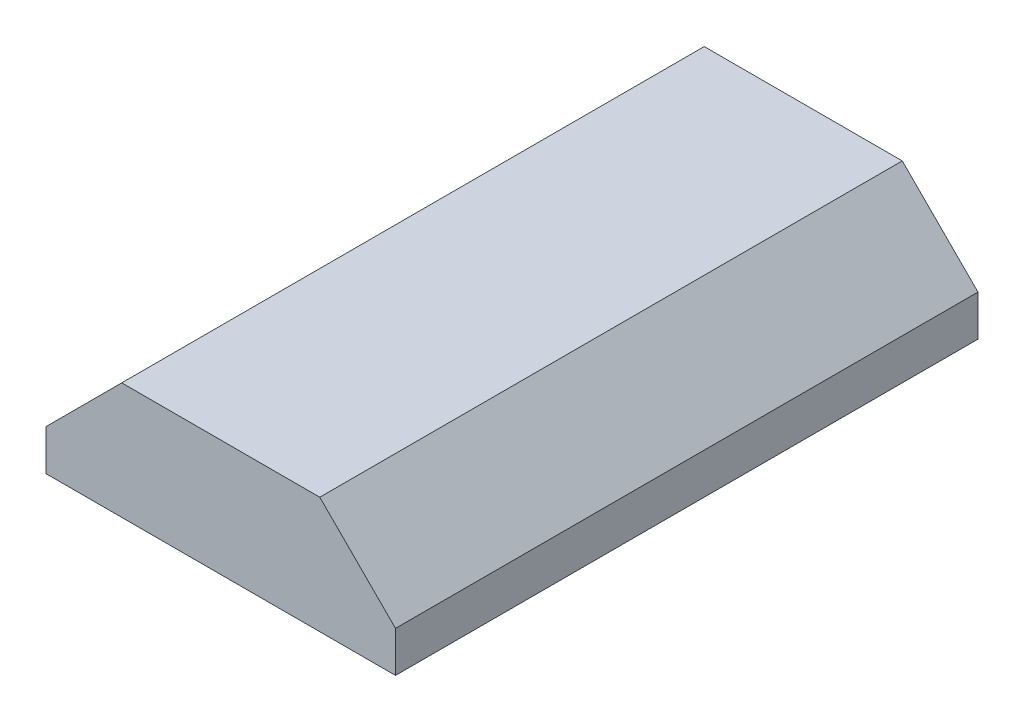
from build123d import *

# Parameters (mm, degrees)
AUFSATZ_LINEAR_AUSTRAGEN1_DEPTH = 20


with BuildPart() as part:
    # Skizze1 → Aufsatz-Linear austragen1 (new body)
    with BuildSketch(Plane.XY):
        Polygon((3.4, 1.808858787), (-3.4, 1.808858787), (-6, -0.791141213), (-6, -2.191141213), (6, -2.191141213), (6, -0.791141213), align=None)
    extrude(amount=AUFSATZ_LINEAR_AUSTRAGEN1_DEPTH)


solid = part.part
